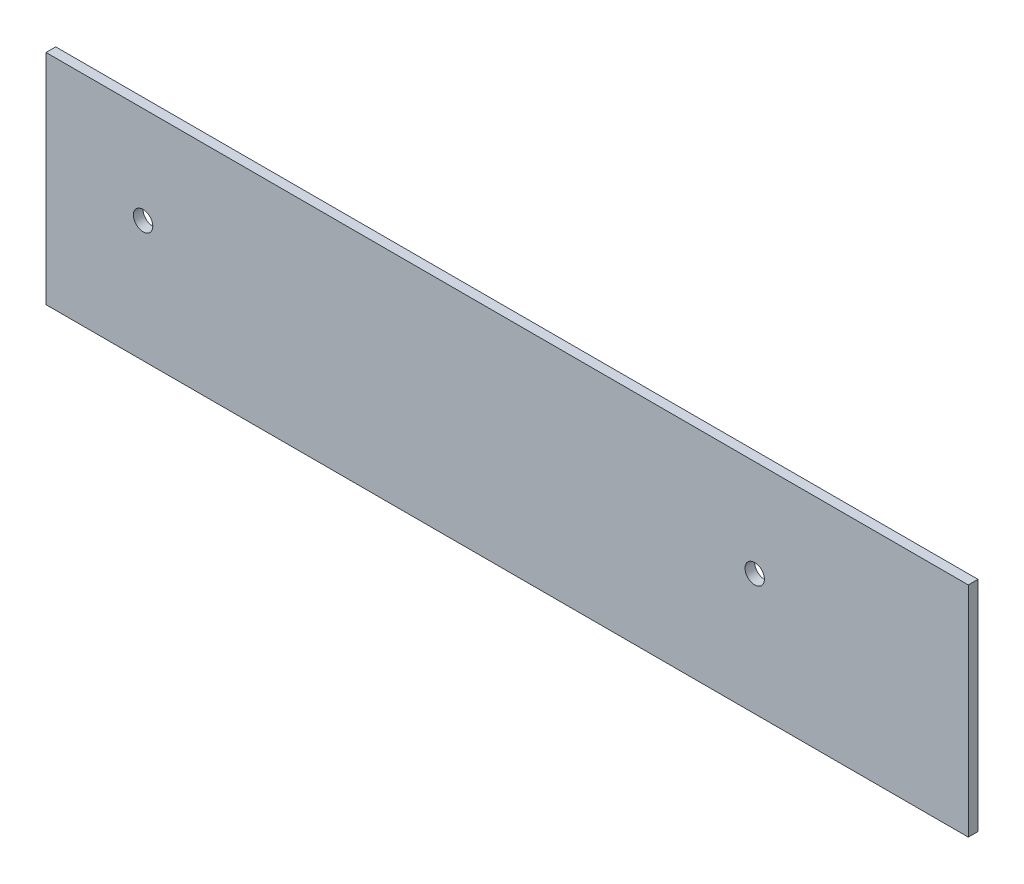
from build123d import *

# Parameters (mm, degrees)
SKETCH2_W           = 190
SKETCH2_H           = 45
BOSS_EXTRUDE1_DEPTH = 2
SKETCH3_R           = 2
CUT_EXTRUDE1_DEPTH  = 2


with BuildPart() as part:
    # Sketch2 → Boss-Extrude1 (new body)
    with BuildSketch(Plane.XY):
        Rectangle(SKETCH2_W, SKETCH2_H)
    extrude(amount=BOSS_EXTRUDE1_DEPTH)

    # Sketch3 → Cut-Extrude1 (cut)
    with BuildSketch(Plane.XY.offset(2)):
        with Locations((-75, 2.5)):
            Circle(SKETCH3_R)
        with Locations((51, 2.5)):
            Circle(SKETCH3_R)
    extrude(amount=-CUT_EXTRUDE1_DEPTH, mode=Mode.SUBTRACT)


solid = part.part
